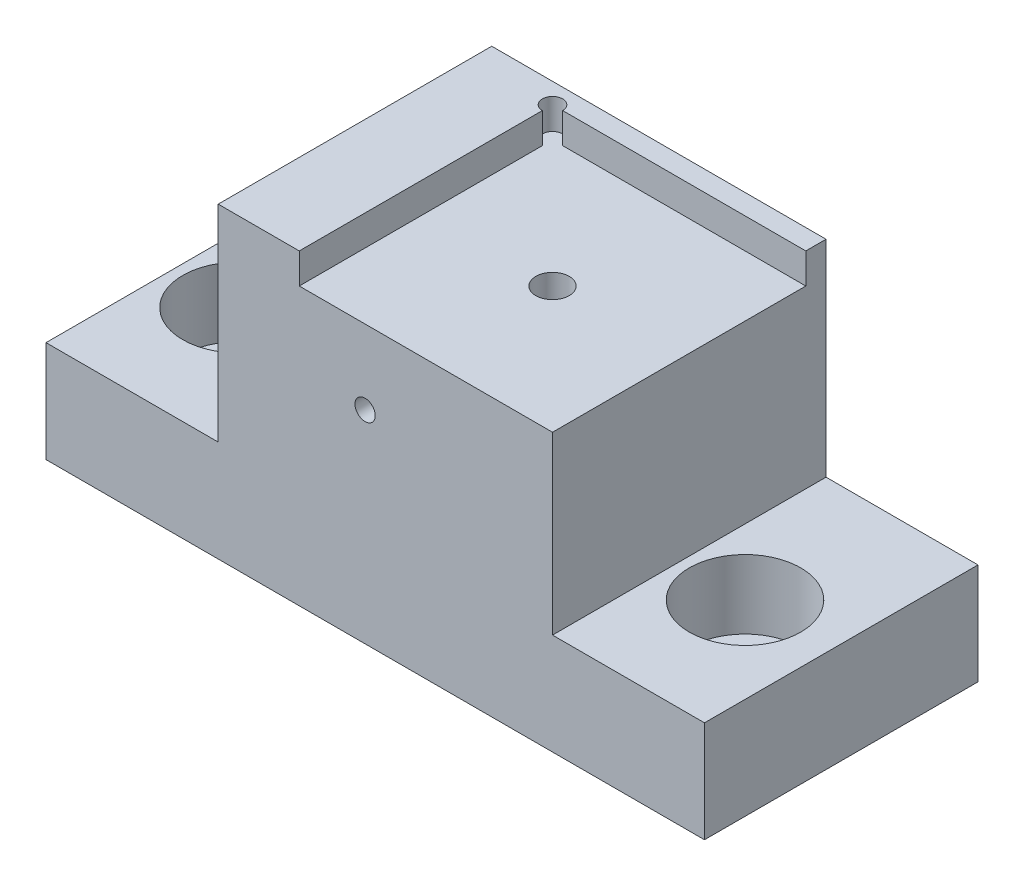
from build123d import *

# Parameters (mm, degrees)
SKETCH_1_W                = 29
SKETCH_1_H                = 29
EXTRUDE_1_DEPTH           = 5
SKETCH_2_W                = 25
SKETCH_2_H                = 25
CUT_EXTRUDE_1_DEPTH       = 3
SKETCH_3_W                = 35
SKETCH_3_H                = 29
EXTRUDE_747_DEPTH         = 25.341167732
HOLE_WIZARD_M4_1_D        = 3.3
HOLE_WIZARD_M4_1_DEPTH    = 10.1
HOLE_WIZARD_M4_1_TIP      = 0.991420021
SKETCH_9_R                = 1
CUT_EXTRUDE_2_DEPTH       = 3
SKETCH_11_W               = 29
SKETCH_11_H               = 5
EXTRUDE_4_DEPTH           = 6
CUT_EXTRUDE_8_DEPTH       = 40.383835
SKETCH_19_W               = 80
SKETCH_19_H               = 25
EXTRUDE_5_DEPTH           = 10
HOLE_WIZARD_1_D           = 6.6
HOLE_WIZARD_1_DEPTH       = 10.1
HOLE_WIZARD_1_CBORE_D     = 11
HOLE_WIZARD_1_CBORE_DEPTH = 6.8
HOLE_WIZARD_1_TIP         = 1.982840043
SKETCH_23_W               = 80
SKETCH_23_H               = 10
EXTRUDE_6_DEPTH           = 2
SKETCH_24_W               = 27
SKETCH_24_H               = 10
CUT_EXTRUDE_9_DEPTH       = 2
MM_1_D                    = 4
MM_1_DEPTH                = 5
MM_1_TIP                  = 1.201721238
CUT_EXTRUDE_10_DEPTH      = 5
SKETCH_28_R               = 1
CUT_EXTRUDE_11_DEPTH      = 2
HOLE_WIZARD_M6_1_D        = 5
HOLE_WIZARD_M6_1_DEPTH    = 10
HOLE_WIZARD_M6_1_TIP      = 1.502151548
CUT_EXTRUDE_12_DEPTH      = 62.837260656
CUT_EXTRUDE_12_DEPTH_BACK = 62.837260656
SKETCH_32_W               = 27
SKETCH_32_H               = 10
CUT_EXTRUDE_13_DEPTH      = 6.5
SKETCH_33_W               = 27
SKETCH_33_H               = 10
CUT_EXTRUDE_14_DEPTH      = 6.5
CUT_EXTRUDE_15_DEPTH      = 5
MM_2_D                    = 4
MM_2_DEPTH                = 5
MM_2_TIP                  = 1.201721238
MM_3_D                    = 4
MM_3_DEPTH                = 5
MM_3_TIP                  = 1.201721238
SKETCH_38_W               = 23.961905905
SKETCH_38_H               = 13.839319444
EXTRUDE_7_DEPTH           = 27


with BuildPart() as part:
    # 草图1 → 凸台-拉伸1 (new body)
    with BuildSketch(Plane(origin=(0, 0, 0), x_dir=(1, 0, 0), z_dir=(0, 1, 0))):
        Rectangle(SKETCH_1_W, SKETCH_1_H)
    extrude(amount=EXTRUDE_1_DEPTH)

    # 草图2 → 切除-拉伸1 (cut)
    with BuildSketch(Plane.XZ.offset(-5)):
        Rectangle(SKETCH_2_W, SKETCH_2_H)
    extrude(amount=CUT_EXTRUDE_1_DEPTH, mode=Mode.SUBTRACT)

    # 草图3 → Extrude 747 (add)
    with BuildSketch(Plane(origin=(0, 0, 0), x_dir=(-1, 0, 0), z_dir=(0, -1, 0))):
        with Locations((3, 0)):
            Rectangle(SKETCH_3_W, SKETCH_3_H)
    extrude(amount=EXTRUDE_747_DEPTH)

    # M4 螺纹孔1
    with Locations(Plane.ZX.offset(2)):
        with Locations((0, 0)):
            Hole(HOLE_WIZARD_M4_1_D / 2, depth=HOLE_WIZARD_M4_1_DEPTH)
            with Locations((0, 0, -(HOLE_WIZARD_M4_1_DEPTH + HOLE_WIZARD_M4_1_TIP / 2))):  # 118° drill point
                Cone(0, HOLE_WIZARD_M4_1_D / 2, HOLE_WIZARD_M4_1_TIP, mode=Mode.SUBTRACT)

    # 草图9 → 切除-拉伸2 (cut)
    with BuildSketch(Plane(origin=(0, 5, 0), x_dir=(1, 0, 0), z_dir=(0, 1, 0))):
        with Locations((-12.5, 12.5)):
            Circle(SKETCH_9_R)
    extrude(amount=-CUT_EXTRUDE_2_DEPTH, mode=Mode.SUBTRACT)

    # 草图11 → 凸台-拉伸4 (add)
    with BuildSketch(Plane.ZY.offset(14.5)):
        with Locations((0, 2.5)):
            Rectangle(SKETCH_11_W, SKETCH_11_H)
    extrude(amount=EXTRUDE_4_DEPTH)

    # 草图17 → 切除-拉伸8 (cut, through all)
    with BuildSketch(Plane(origin=(0, 5, 0), x_dir=(1, 0, 0), z_dir=(0, 1, 0))):
        Polygon((-20.5, -14.5), (14.5, -14.5), (14.5, 14.5), (12.5, 14.5), (12.5, -12.5), (-20.5, -12.5), align=None)
    extrude(amount=-CUT_EXTRUDE_8_DEPTH, mode=Mode.SUBTRACT)

    # 草图19 → 凸台-拉伸5 (add)
    with BuildSketch(Plane(origin=(0, -25.341167732, 0), x_dir=(-1, 0, 0), z_dir=(0, -1, 0))):
        with Locations((6, 0)):
            Rectangle(SKETCH_19_W, SKETCH_19_H)
    extrude(amount=-EXTRUDE_5_DEPTH)

    # 打孔尺寸(%根据)内六角圆柱头螺钉的类型1
    with Locations(Plane(origin=(-31, -15.341167732, 0), x_dir=(0, 0, 1), z_dir=(0, 1, 0))):
        with Locations((0, 0), (0, 50)):
            CounterBoreHole(HOLE_WIZARD_1_D / 2, HOLE_WIZARD_1_CBORE_D / 2, HOLE_WIZARD_1_CBORE_DEPTH, depth=HOLE_WIZARD_1_DEPTH)
            with Locations((0, 0, -(HOLE_WIZARD_1_DEPTH + HOLE_WIZARD_1_TIP / 2))):  # 118° drill point
                Cone(0, HOLE_WIZARD_1_D / 2, HOLE_WIZARD_1_TIP, mode=Mode.SUBTRACT)

    # 草图23 → 凸台-拉伸6 (add)
    with BuildSketch(Plane(origin=(0, 0, -12.5), x_dir=(-1, 0, 0), z_dir=(0, 0, -1))):
        with Locations((6, -20.341167732)):
            Rectangle(SKETCH_23_W, SKETCH_23_H)
    extrude(amount=EXTRUDE_6_DEPTH)

    # 草图24 → 切除-拉伸9 (cut)
    with BuildSketch(Plane.ZY.offset(46)):
        with Locations((-1, -20.341167732)):
            Rectangle(SKETCH_24_W, SKETCH_24_H)
    extrude(amount=-CUT_EXTRUDE_9_DEPTH, mode=Mode.SUBTRACT)

    # 大小mm 暗销孔1
    with Locations(Plane(origin=(-21, -25.341167732, 0), x_dir=(0, 0, -1), z_dir=(0, -1, 0))):
        with Locations((0, 0)):
            Hole(MM_1_D / 2, depth=MM_1_DEPTH)
            with Locations((0, 0, -(MM_1_DEPTH + MM_1_TIP / 2))):  # 118° drill point
                Cone(0, MM_1_D / 2, MM_1_TIP, mode=Mode.SUBTRACT)

    # 草图27 → 切除-拉伸10 (cut)
    with BuildSketch(Plane.XZ.offset(25.341167732)):
        with BuildLine():
            Line((8.5, 2), (9.5, 2))
            ThreePointArc((9.5, 2), (11.5, 0), (9.5, -2))
            Line((9.5, -2), (8.5, -2))
            ThreePointArc((8.5, -2), (6.5, 0), (8.5, 2))
        make_face()
    extrude(amount=-CUT_EXTRUDE_10_DEPTH, mode=Mode.SUBTRACT)

    # 草图28 → 切除-拉伸11 (cut)
    with BuildSketch(Plane.XY.offset(12.5)):
        with Locations((-6, -5.341167732)):
            Circle(SKETCH_28_R)
    extrude(amount=-CUT_EXTRUDE_11_DEPTH, mode=Mode.SUBTRACT)

    # M6 螺纹孔1
    with Locations(Plane(origin=(-6, -25.341167732, 0), x_dir=(0, 0, -1), z_dir=(0, -1, 0))):
        with Locations((0, 0)):
            Hole(HOLE_WIZARD_M6_1_D / 2, depth=HOLE_WIZARD_M6_1_DEPTH)
            with Locations((0, 0, -(HOLE_WIZARD_M6_1_DEPTH + HOLE_WIZARD_M6_1_TIP / 2))):  # 118° drill point
                Cone(0, HOLE_WIZARD_M6_1_D / 2, HOLE_WIZARD_M6_1_TIP, mode=Mode.SUBTRACT)

    # 草图31 → 切除-拉伸12 (cut, two sides: drawn at the far end of the back side and taken through both)
    with BuildSketch(Plane(origin=(-6.0032, 14.658832268, 10.4718), x_dir=(1, 0, 0), z_dir=(0, 0, 1)).offset(-CUT_EXTRUDE_12_DEPTH_BACK)):
        with BuildLine():
            Line((10.117055245, -31.7), (8.854085532, -31.7))
            Line((8.854085532, -31.7), (6.07517942, -36.564132504))
            Line((6.07517942, -36.564132504), (6.531795149, -36.824999624))
            Line((6.531795149, -36.824999624), (10.275, -36.824999624))
            ThreePointArc((10.275, -36.824999624), (11.025, -37.574999624), (10.275, -38.324999624))
            Line((10.275, -38.324999624), (9.525, -38.324999624))
            Line((9.525, -38.324999624), (9.525, -40))
            Line((9.525, -40), (-9.776101272, -40))
            Line((-9.776101272, -40), (-9.776101272, -38.074384714))
            Line((-9.776101272, -38.074384714), (-10.526101272, -38.074384714))
            ThreePointArc((-10.526101272, -38.074384714), (-11.276101272, -37.324384714), (-10.526101272, -36.574384714))
            Line((-10.526101272, -36.574384714), (-6.501264425, -36.574384714))
            Line((-6.501264425, -36.574384714), (-6.501264425, -36.324384714))
            Line((-6.501264425, -36.324384714), (-9.143201284, -31.7))
            Line((-9.143201284, -31.7), (-10.369175052, -31.7))
            ThreePointArc((-10.369175052, -31.7), (-11.119175052, -30.95), (-10.369175052, -30.2))
            Line((-10.369175052, -30.2), (10.117055245, -30.2))
            ThreePointArc((10.117055245, -30.2), (10.867055245, -30.95), (10.117055245, -31.7))
        make_face()
    extrude(amount=CUT_EXTRUDE_12_DEPTH + CUT_EXTRUDE_12_DEPTH_BACK, mode=Mode.SUBTRACT)

    # 草图32 → 切除-拉伸13 (cut)
    with BuildSketch(Plane.ZY.offset(44)):
        with Locations((-1, -20.341167732)):
            Rectangle(SKETCH_32_W, SKETCH_32_H)
    extrude(amount=-CUT_EXTRUDE_13_DEPTH, mode=Mode.SUBTRACT)

    # 草图33 → 切除-拉伸14 (cut)
    with BuildSketch(Plane(origin=(34, 0, 0), x_dir=(0, 0, -1), z_dir=(1, 0, 0))):
        with Locations((1, -20.341167732)):
            Rectangle(SKETCH_33_W, SKETCH_33_H)
    extrude(amount=-CUT_EXTRUDE_14_DEPTH, mode=Mode.SUBTRACT)

    # 草图35 → 切除-拉伸15 (cut)
    with BuildSketch(Plane.XZ.offset(25.341167732)):
        with BuildLine():
            Line((8.5, -6), (9.5, -6))
            ThreePointArc((9.5, -6), (11.5, -8), (9.5, -10))
            Line((9.5, -10), (8.5, -10))
            ThreePointArc((8.5, -10), (6.5, -8), (8.5, -6))
        make_face()
    extrude(amount=-CUT_EXTRUDE_15_DEPTH, mode=Mode.SUBTRACT)

    # 大小mm 暗销孔2
    with Locations(Plane(origin=(-21, -25.341167732, -8), x_dir=(0, 0, -1), z_dir=(0, -1, 0))):
        with Locations((0, 0)):
            Hole(MM_2_D / 2, depth=MM_2_DEPTH)
            with Locations((0, 0, -(MM_2_DEPTH + MM_2_TIP / 2))):  # 118° drill point
                Cone(0, MM_2_D / 2, MM_2_TIP, mode=Mode.SUBTRACT)

    # 大小mm 暗销孔3
    with Locations(Plane(origin=(-21, -25.341167732, 8), x_dir=(0, 0, -1), z_dir=(0, -1, 0))):
        with Locations((0, 0)):
            Hole(MM_3_D / 2, depth=MM_3_DEPTH)
            with Locations((0, 0, -(MM_3_DEPTH + MM_3_TIP / 2))):  # 118° drill point
                Cone(0, MM_3_D / 2, MM_3_TIP, mode=Mode.SUBTRACT)

    # 草图38 → 凸台-拉伸7 (add)
    with BuildSketch(Plane.XY.offset(12.5)):
        with Locations((-6.428193068, -18.42150801)):
            Rectangle(SKETCH_38_W, SKETCH_38_H)
    extrude(amount=-EXTRUDE_7_DEPTH)


solid = part.part
